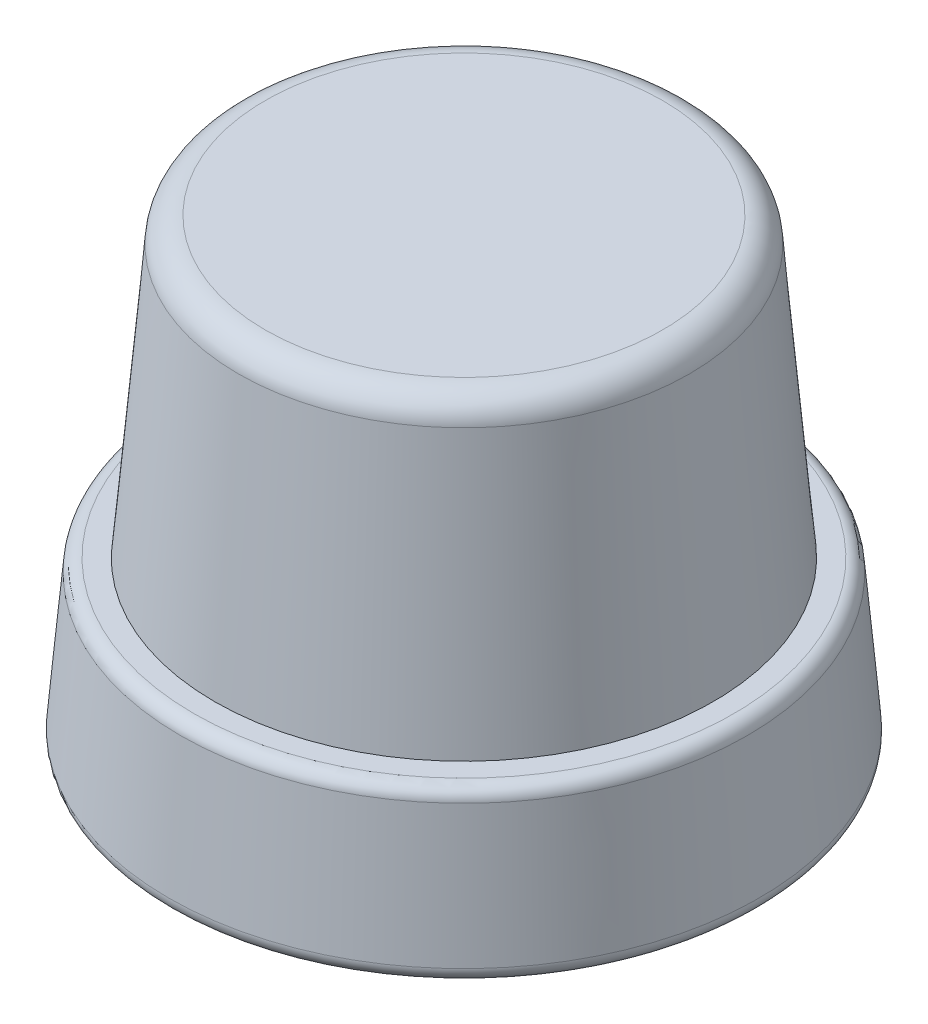
from build123d import *

# Parameters (mm, degrees)
SKETCH1_R           = 11
BOSS_EXTRUDE1_DEPTH = 6
BOSS_EXTRUDE1_TAPER = 5
SKETCH2_R           = 9.25
BOSS_EXTRUDE2_DEPTH = 11
BOSS_EXTRUDE2_TAPER = 5
SKETCH3_R           = 3.05
CUT_EXTRUDE1_DEPTH  = 8
FILLET1_R           = 1
FILLET2_R           = 0.5
FILLET3_R           = 0.5


with BuildPart() as part:
    # Sketch1 → Boss-Extrude1 (new body)
    with BuildSketch(Plane(origin=(0, 0, 0), x_dir=(1, 0, 0), z_dir=(0, 1, 0))):
        Circle(SKETCH1_R)
    extrude(amount=BOSS_EXTRUDE1_DEPTH, taper=BOSS_EXTRUDE1_TAPER)

    # Sketch2 → Boss-Extrude2 (add)
    with BuildSketch(Plane(origin=(0, 6, 0), x_dir=(1, 0, 0), z_dir=(0, 1, 0))):
        Circle(SKETCH2_R)
    extrude(amount=BOSS_EXTRUDE2_DEPTH, taper=BOSS_EXTRUDE2_TAPER)

    # Sketch3 → Cut-Extrude1 (cut)
    with BuildSketch(Plane.XZ):
        Circle(SKETCH3_R)
    extrude(amount=-CUT_EXTRUDE1_DEPTH, mode=Mode.SUBTRACT)

    # Fillet1
    fillet1_edges = [part.edges().sort_by_distance(p)[0] for p in [
        (-8.287624701, 17, 0),
    ]]
    fillet(fillet1_edges, radius=FILLET1_R)

    # Fillet2
    fillet2_edges = [part.edges().sort_by_distance(p)[0] for p in [
        (-10.475068019, 6, 0),
    ]]
    fillet(fillet2_edges, radius=FILLET2_R)

    # Fillet3
    fillet3_edges = [part.edges().sort_by_distance(p)[0] for p in [
        (-11, 0, 0),
    ]]
    fillet(fillet3_edges, radius=FILLET3_R)


solid = part.part
